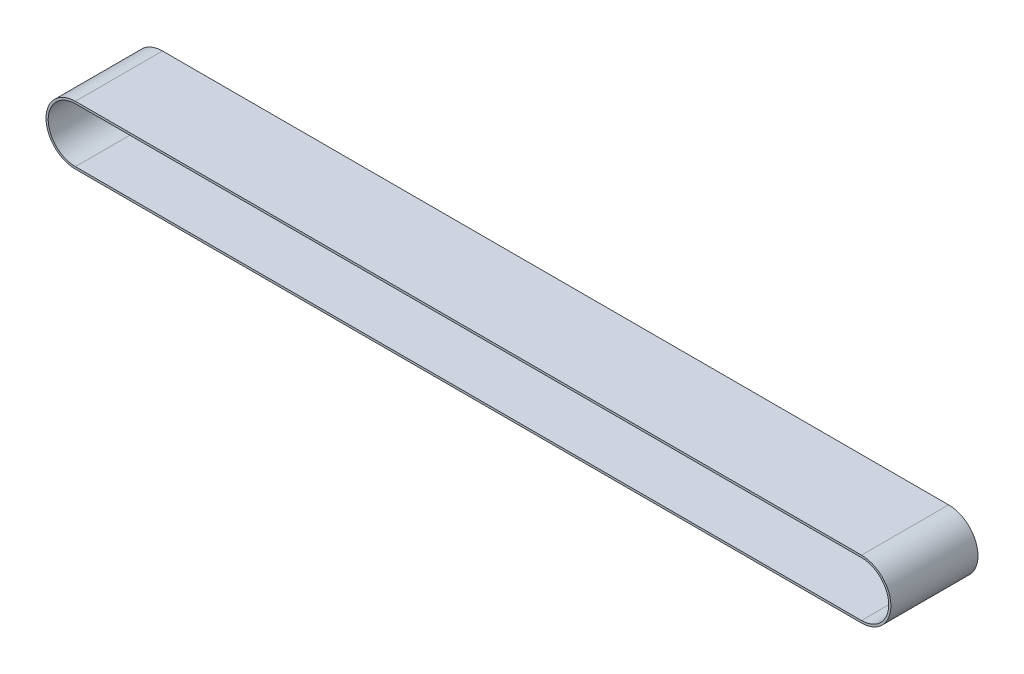
from build123d import *

# Parameters (mm, degrees)
RESSALTO_EXTRUS_O1_DEPTH = 80


with BuildPart() as part:
    # Esboço1 → Ressalto-extrusão1 (new body)
    with BuildSketch(Plane.XY):
        with BuildLine():
            Line((345.122813731, -0.153737706), (-376.877186269, -0.153737706))
            ThreePointArc((-376.877186269, -0.153737706), (-403.877186269, 26.846262294), (-376.877186269, 53.846262294))
            Line((-376.877186269, 53.846262294), (345.122813731, 53.846262294))
            ThreePointArc((345.122813731, 53.846262294), (372.122813731, 26.846262294), (345.122813731, -0.153737706))
        make_face()
        with BuildLine():
            Line((345.122813731, 1.846262294), (-376.877186269, 1.846262294))
            ThreePointArc((-376.877186269, 1.846262294), (-401.877186269, 26.846262294), (-376.877186269, 51.846262294))
            Line((-376.877186269, 51.846262294), (345.122813731, 51.846262294))
            ThreePointArc((345.122813731, 51.846262294), (370.122813731, 26.846262294), (345.122813731, 1.846262294))
        make_face(mode=Mode.SUBTRACT)
    extrude(amount=RESSALTO_EXTRUS_O1_DEPTH)


solid = part.part
